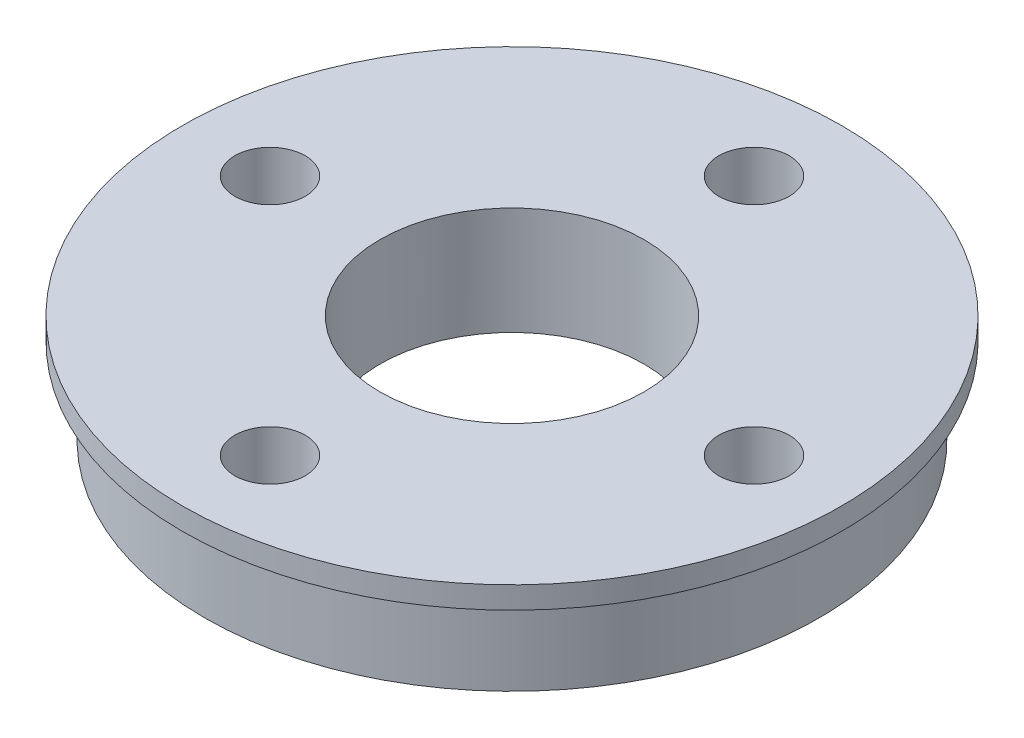
from build123d import *

# Parameters (mm, degrees)
SKETCH_1_R               = 13.98
EXTRUDE_1_DEPTH          = 4
SKETCH_2_R               = 14.98
EXTRUDE_2_DEPTH          = 1
SKETCH_3_R               = 7.97
EXTRUDE_3_DEPTH          = 2
SKETCH_5_R               = 6
SKETCH_5_R_2             = 1.6
CUT_EXTRUDE_1_DEPTH      = 21
SKETCH_7_R               = 13.98
SKETCH_7_R_2             = 7.97
CUT_EXTRUDE_4_DEPTH      = 0.1
CUT_EXTRUDE_5_DEPTH      = 10
CUT_EXTRUDE_5_DEPTH_BACK = 10
SKETCH_8_W               = 15.94
SKETCH_8_H               = 2.1


with BuildPart() as part:
    # 草图1 → 凸台-拉伸1 (new body)
    with BuildSketch(Plane(origin=(0, 0, 0), x_dir=(1, 0, 0), z_dir=(0, 1, 0))):
        Circle(SKETCH_1_R)
    extrude(amount=EXTRUDE_1_DEPTH)

    # 草图2 → 凸台-拉伸2 (add)
    with BuildSketch(Plane(origin=(0, 4, 0), x_dir=(1, 0, 0), z_dir=(0, 1, 0))):
        Circle(SKETCH_2_R)
    extrude(amount=EXTRUDE_2_DEPTH)

    # 草图3 → 凸台-拉伸3 (add)
    with BuildSketch(Plane.XZ):
        Circle(SKETCH_3_R)
    extrude(amount=EXTRUDE_3_DEPTH)

    # 草图5 → 切除-拉伸1 (cut)
    with BuildSketch(Plane.XZ.offset(2)):
        Circle(SKETCH_5_R)
        with Locations((0, 11)):
            Circle(SKETCH_5_R_2)
        with Locations((11, 0)):
            Circle(SKETCH_5_R_2)
        with Locations((0, -11)):
            Circle(SKETCH_5_R_2)
        with Locations((-11, 0)):
            Circle(SKETCH_5_R_2)
    extrude(amount=-CUT_EXTRUDE_1_DEPTH, mode=Mode.SUBTRACT)

    # 草图7 → 切除-拉伸4 (cut)
    with BuildSketch(Plane.XZ):
        Circle(SKETCH_7_R)
        Circle(SKETCH_7_R_2, mode=Mode.SUBTRACT)
    extrude(amount=-CUT_EXTRUDE_4_DEPTH, mode=Mode.SUBTRACT)

    # 草图8 → 切除-拉伸5 (cut, two sides: drawn at the far end of the back side and taken through both)
    with BuildSketch(Plane(origin=(0, 0, 0), x_dir=(0, 0, -1), z_dir=(1, 0, 0)).offset(-CUT_EXTRUDE_5_DEPTH_BACK)):
        with Locations((0, -0.95)):
            Rectangle(SKETCH_8_W, SKETCH_8_H)
    extrude(amount=CUT_EXTRUDE_5_DEPTH + CUT_EXTRUDE_5_DEPTH_BACK, mode=Mode.SUBTRACT)


solid = part.part
